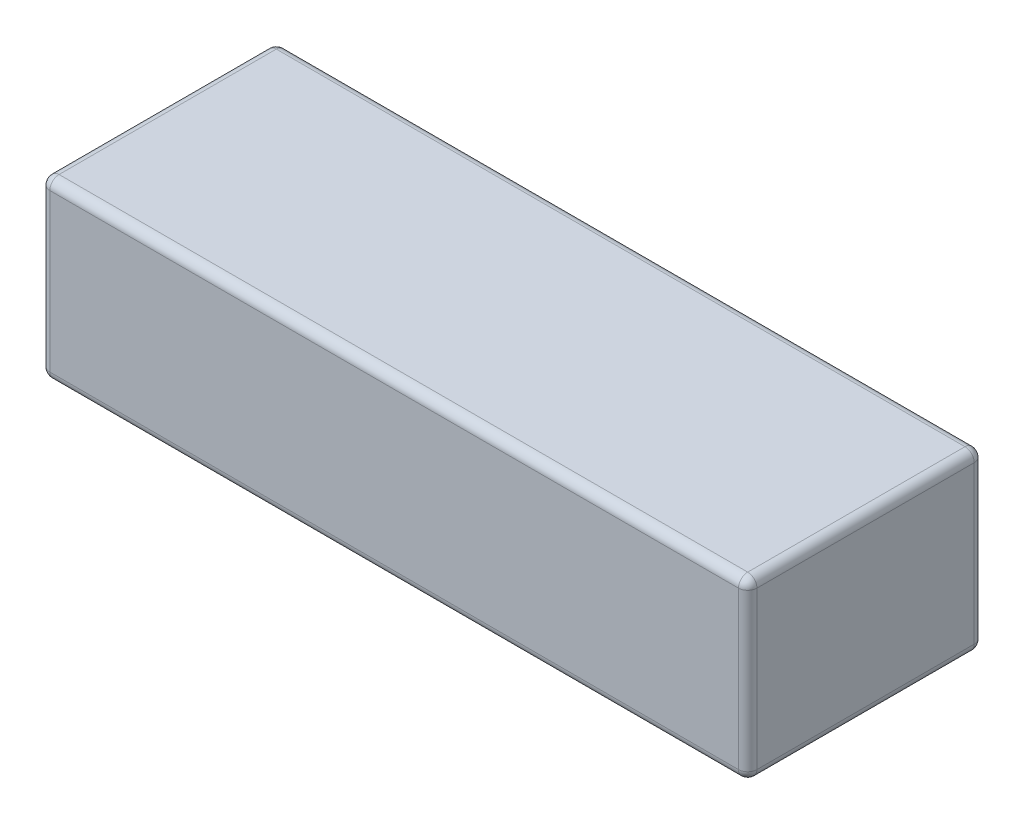
from build123d import *

# Parameters (mm, degrees)
IZIM1_W                     = 153
IZIM1_H                     = 38
Y_KSEKLIK_EKSTR_ZYON1_DEPTH = 51
RADYUS1_R                   = 2


with BuildPart() as part:
    # Çizim1 → Yükseklik-Ekstrüzyon1 (new body)
    with BuildSketch(Plane.XY):
        with Locations((76.5, 19)):
            Rectangle(IZIM1_W, IZIM1_H)
    extrude(amount=Y_KSEKLIK_EKSTR_ZYON1_DEPTH)

    # Radyus1
    radyus1_edges = [part.edges().sort_by_distance(p)[0] for p in [
        (153, 19, 51),
        (76.5, 38, 51),
        (0, 19, 51),
        (76.5, 38, 0),
        (153, 19, 0),
        (76.5, 0, 0),
        (0, 19, 0),
        (0, 38, 25.5),
        (153, 38, 25.5),
        (153, 0, 25.5),
        (0, 0, 25.5),
        (76.5, 0, 51),
    ]]
    fillet(radyus1_edges, radius=RADYUS1_R)


solid = part.part
